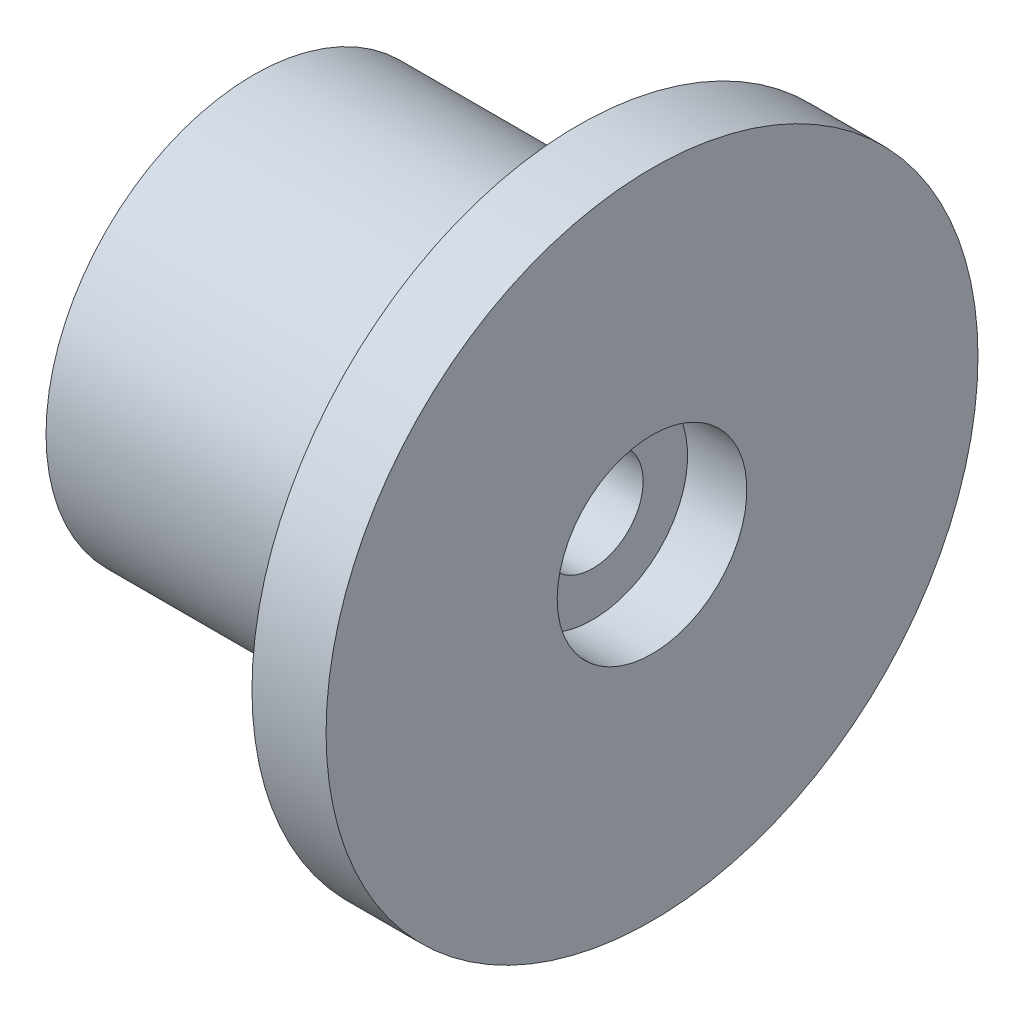
from build123d import *


with BuildPart() as part:
    # Sketch1 → Pin (revolve)
    with BuildSketch(Plane.XY, mode=Mode.PRIVATE) as pin_sk:
        Polygon((0, 1.7), (0, 7), (10.95, 7), (10.95, 11), (13.45, 11), (13.45, 3.2), (11.45, 3.2), (11.45, 1.7), align=None)
    revolve(pin_sk.sketch.rotate(Axis((-5, 0, 0), (1, 0, 0)), 90), axis=Axis((-5, 0, 0), (1, 0, 0)))


solid = part.part
